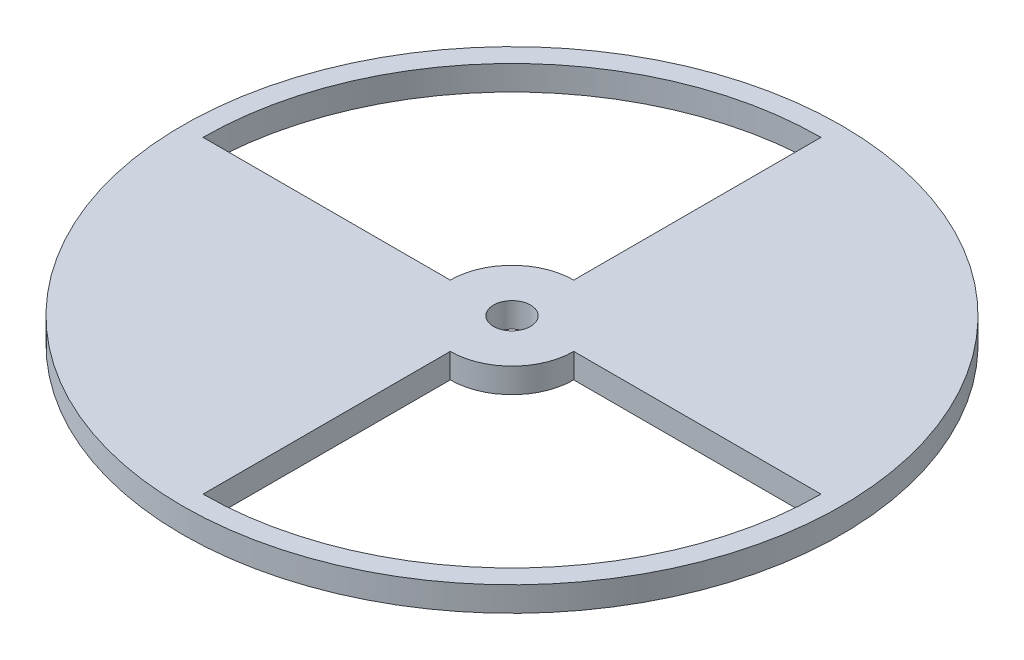
from build123d import *

# Parameters (mm, degrees)
SKETCH_1_R          = 40
SKETCH_1_R_2        = 2.25
EXTRUDE_1_DEPTH     = 3
CUT_EXTRUDE_1_REACH = 58.648


with BuildPart() as part:
    # 草图1 → 凸台-拉伸1 (new body)
    with BuildSketch(Plane(origin=(0, 0, 0), x_dir=(1, 0, 0), z_dir=(0, 1, 0))):
        with Locations(Location((0, 0, 0), (0, 0, 270))):
            Circle(SKETCH_1_R)
        with Locations(Location((0, 0, 0), (0, 0, 270))):
            Circle(SKETCH_1_R_2, mode=Mode.SUBTRACT)
    extrude(amount=EXTRUDE_1_DEPTH)

    # 草图2 → 切除-拉伸1 (cut, up to next)
    with BuildSketch(Plane(origin=(0, 3, 0), x_dir=(1, 0, 0), z_dir=(0, 1, 0)), mode=Mode.PRIVATE) as cut_extrude_1_sk1:
        with BuildLine():
            Line((-37.5, 0), (-7.5, 0))
            ThreePointArc((-7.5, 0), (-5.303300859, 5.303300859), (0, 7.5))
            Line((0, 7.5), (0, 37.5))
            ThreePointArc((0, 37.5), (-26.516504294, 26.516504294), (-37.5, 0))
        make_face()
    cut_extrude_1_tool1 = extrude(cut_extrude_1_sk1.sketch, amount=-CUT_EXTRUDE_1_REACH, mode=Mode.PRIVATE) & part.part
    # 草图2 → 切除-拉伸1 (cut, up to next)
    with BuildSketch(Plane(origin=(0, 3, 0), x_dir=(1, 0, 0), z_dir=(0, 1, 0)), mode=Mode.PRIVATE) as cut_extrude_1_sk2:
        with BuildLine():
            Line((7.5, 0), (37.5, 0))
            ThreePointArc((37.5, 0), (26.516504294, -26.516504294), (0, -37.5))
            Line((0, -37.5), (0, -7.5))
            ThreePointArc((0, -7.5), (5.303300859, -5.303300859), (7.5, 0))
        make_face()
    cut_extrude_1_tool2 = extrude(cut_extrude_1_sk2.sketch, amount=-CUT_EXTRUDE_1_REACH, mode=Mode.PRIVATE) & part.part
    add(cut_extrude_1_tool1.solids().sort_by_distance((-16.446011, 3, -16.446011))[0], mode=Mode.SUBTRACT)
    add(cut_extrude_1_tool2.solids().sort_by_distance((16.446011, 3, 16.446011))[0], mode=Mode.SUBTRACT)


solid = part.part
